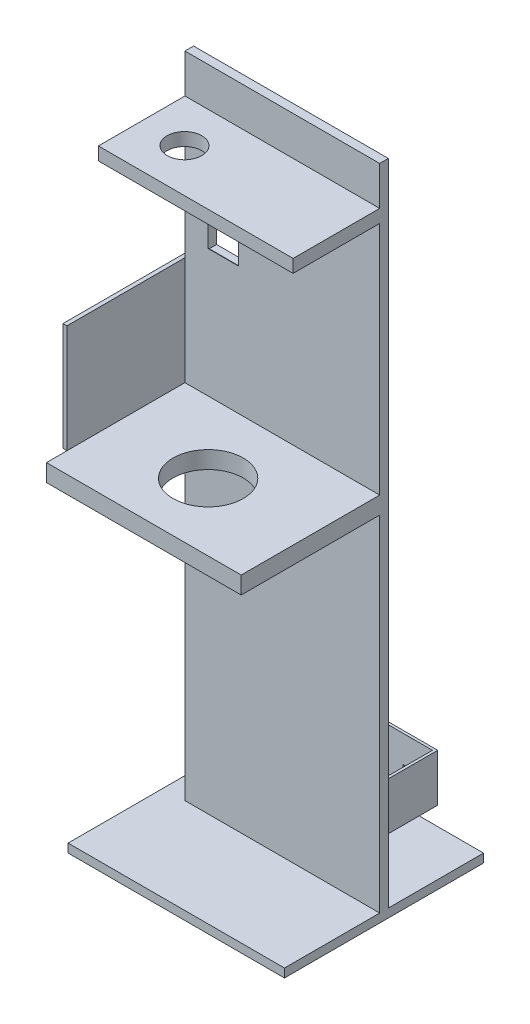
from build123d import *

# Parameters (mm, degrees)
CROQUIS1_W               = 250
CROQUIS1_H               = 120
SALIENTE_EXTRUIR1_DEPTH  = 10
CROQUIS2_W               = 250
CROQUIS2_H               = 10
SALIENTE_EXTRUIR2_DEPTH  = 750
CROQUIS3_W               = 190.013667147
CROQUIS3_H               = 5
SALIENTE_EXTRUIR3_DEPTH  = 87
CROQUIS4_W               = 94.664916229
CROQUIS4_H               = 63.645151041
CROQUIS4_W_2             = 90.664916229
CROQUIS4_H_2             = 59.645151041
SALIENTE_EXTRUIR4_DEPTH  = 12
SALIENTE_EXTRUIR5_DEPTH  = 50
CROQUIS6_W               = 16.579373852
CROQUIS6_H               = 7.621070837
CORTAR_EXTRUIR1_DEPTH    = 12
CROQUIS7_W               = 35.343962836
CROQUIS7_H               = 31.601732656
CORTAR_EXTRUIR2_DEPTH    = 12
CROQUIS8_W               = 35.343962836
CROQUIS8_H               = 0.5
SALIENTE_EXTRUIR6_DEPTH  = 1
CROQUIS9_W               = 17.06802825
CROQUIS9_H               = 0.5
SALIENTE_EXTRUIR7_DEPTH  = 1
CROQUIS10_W              = 250
CROQUIS10_H              = 10
SALIENTE_EXTRUIR8_DEPTH  = 110
CROQUIS11_W              = 250
CROQUIS11_H              = 15
SALIENTE_EXTRUIR9_DEPTH  = 100
CROQUIS12_R              = 20
CORTAR_EXTRUIR3_DEPTH    = 100
CROQUIS13_W              = 250
CROQUIS13_H              = 20
SALIENTE_EXTRUIR10_DEPTH = 160
CROQUIS14_R              = 40.595017514
CORTAR_EXTRUIR4_DEPTH    = 160
CROQUIS15_W              = 25
CROQUIS15_H              = 750
CORTAR_EXTRUIR5_DEPTH    = 791.963153623
CROQUIS16_W              = 4.56451145
CROQUIS16_H              = 146.448080862
SALIENTE_EXTRUIR11_DEPTH = 125


with BuildPart() as part:
    # Croquis1 → Saliente-Extruir1 (new body)
    with BuildSketch(Plane(origin=(0, 0, 0), x_dir=(1, 0, 0), z_dir=(0, 1, 0))):
        with Locations((-13.284888509, 77.758926711)):
            Rectangle(CROQUIS1_W, CROQUIS1_H)
    extrude(amount=SALIENTE_EXTRUIR1_DEPTH)

    # Croquis2 → Saliente-Extruir2 (add)
    with BuildSketch(Plane(origin=(0, 10, 0), x_dir=(1, 0, 0), z_dir=(0, 1, 0))):
        with Locations((-13.284888509, 132.758926711)):
            Rectangle(CROQUIS2_W, CROQUIS2_H)
    extrude(amount=SALIENTE_EXTRUIR2_DEPTH)

    # Croquis3 → Saliente-Extruir3 (add)
    with BuildSketch(Plane(origin=(0, 0, -137.758926711), x_dir=(-1, 0, 0), z_dir=(0, 0, -1))):
        with Locations((13.284888509, 56.856532068)):
            Rectangle(CROQUIS3_W, CROQUIS3_H)
    extrude(amount=SALIENTE_EXTRUIR3_DEPTH)

    # Croquis4 → Saliente-Extruir4 (add)
    with BuildSketch(Plane(origin=(0, 59.356532068, 0), x_dir=(1, 0, 0), z_dir=(0, 1, 0))):
        with Locations((26.01643171, 171.173921802)):
            Rectangle(CROQUIS4_W, CROQUIS4_H)
        with Locations((26.01643171, 171.173921802)):
            Rectangle(CROQUIS4_W_2, CROQUIS4_H_2, mode=Mode.SUBTRACT)
    extrude(amount=SALIENTE_EXTRUIR4_DEPTH)

    # Croquis5 → Saliente-Extruir5 (add)
    with BuildSketch(Plane(origin=(0, 59.356532068, 0), x_dir=(1, 0, 0), z_dir=(0, 1, 0))):
        Polygon((78.721945065, 137.758926711), (81.721945065, 137.758926711), (81.721945065, 224.758926711), (-108.291722082, 224.758926711), (-108.291722082, 137.758926711), (-105.291722082, 137.758926711), (-105.291722082, 141.512872832), (-105.291722082, 221.758926711), (78.721945065, 221.758926711), (78.721945065, 141.512872832), align=None)
    extrude(amount=SALIENTE_EXTRUIR5_DEPTH)

    # Croquis6 → Cortar-Extruir1 (cut)
    with BuildSketch(Plane(origin=(0, 0, -224.758926711), x_dir=(-1, 0, 0), z_dir=(0, 0, -1))):
        with Locations((-52.652753503, 74.192072615)):
            Rectangle(CROQUIS6_W, CROQUIS6_H)
    extrude(amount=-CORTAR_EXTRUIR1_DEPTH, mode=Mode.SUBTRACT)

    # Croquis7 → Cortar-Extruir2 (cut)
    with BuildSketch(Plane.XY.offset(-127.758926711)):
        with Locations((-68.994259572, 590.534379378)):
            Rectangle(CROQUIS7_W, CROQUIS7_H)
    extrude(amount=-CORTAR_EXTRUIR2_DEPTH, mode=Mode.SUBTRACT)

    # Croquis8 → Saliente-Extruir6 (add)
    with BuildSketch(Plane(origin=(0, 574.73351305, 0), x_dir=(1, 0, 0), z_dir=(0, 1, 0))):
        with Locations((-68.994259572, 128.008926711)):
            Rectangle(CROQUIS8_W, CROQUIS8_H)
    extrude(amount=SALIENTE_EXTRUIR6_DEPTH)

    # Croquis9 → Saliente-Extruir7 (add)
    with BuildSketch(Plane.XZ.offset(-606.335245706)):
        with Locations((-42.788264029, -128.008926711)):
            Rectangle(CROQUIS9_W, CROQUIS9_H)
    extrude(amount=SALIENTE_EXTRUIR7_DEPTH)

    # Croquis10 → Saliente-Extruir8 (add)
    with BuildSketch(Plane(origin=(0, 0, -137.758926711), x_dir=(-1, 0, 0), z_dir=(0, 0, -1))):
        with Locations((13.284888509, 5)):
            Rectangle(CROQUIS10_W, CROQUIS10_H)
    extrude(amount=SALIENTE_EXTRUIR8_DEPTH)

    # Croquis11 → Saliente-Extruir9 (add)
    with BuildSketch(Plane.XY.offset(-127.758926711)):
        with Locations((-13.284888509, 707.504842282)):
            Rectangle(CROQUIS11_W, CROQUIS11_H)
    extrude(amount=SALIENTE_EXTRUIR9_DEPTH)

    # Croquis12 → Cortar-Extruir3 (cut)
    with BuildSketch(Plane(origin=(0, 715.004842282, 0), x_dir=(1, 0, 0), z_dir=(0, 1, 0))):
        with Locations(Location((-63.842303926, 77.758926711, 0), (0, 0, 270))):
            Circle(CROQUIS12_R)
    extrude(amount=-CORTAR_EXTRUIR3_DEPTH, mode=Mode.SUBTRACT)

    # Croquis13 → Saliente-Extruir10 (add)
    with BuildSketch(Plane.XY.offset(-127.758926711)):
        with Locations((-13.284888509, 418.188422717)):
            Rectangle(CROQUIS13_W, CROQUIS13_H)
    extrude(amount=SALIENTE_EXTRUIR10_DEPTH)

    # Croquis14 → Cortar-Extruir4 (cut)
    with BuildSketch(Plane(origin=(0, 428.188422717, 0), x_dir=(1, 0, 0), z_dir=(0, 1, 0))):
        with Locations(Location((-4.202382173, 45.473050992, 0), (0, 0, 270))):
            Circle(CROQUIS14_R)
    extrude(amount=-CORTAR_EXTRUIR4_DEPTH, mode=Mode.SUBTRACT)

    # Croquis15 → Cortar-Extruir5 (cut, through all)
    with BuildSketch(Plane(origin=(0, 0, -137.758926711), x_dir=(-1, 0, 0), z_dir=(0, 0, -1))):
        with Locations((125.784888509, 385)):
            Rectangle(CROQUIS15_W, CROQUIS15_H)
    extrude(amount=-CORTAR_EXTRUIR5_DEPTH, mode=Mode.SUBTRACT)


with BuildPart() as body_2:
    # Croquis16 → Saliente-Extruir11 (new body)
    with BuildSketch(Plane(origin=(0, 428.188422717, 0), x_dir=(1, 0, 0), z_dir=(0, 1, 0))):
        with Locations((-115.576174025, 64.674173371)):
            Rectangle(CROQUIS16_W, CROQUIS16_H)
    extrude(amount=SALIENTE_EXTRUIR11_DEPTH)


solid = Compound([part.part, body_2.part])
